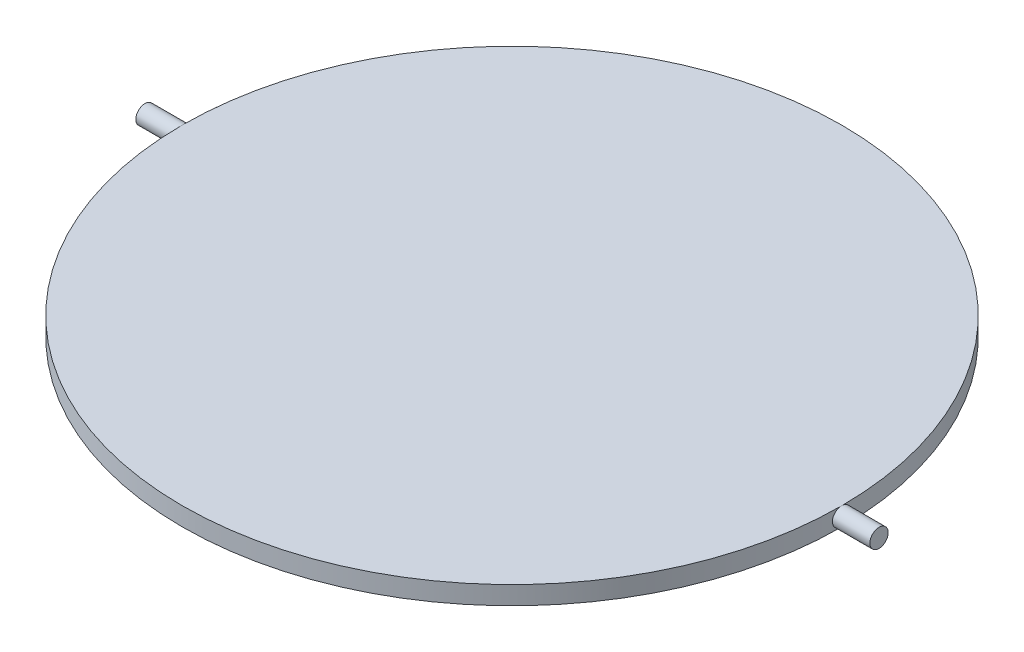
from build123d import *

# Parameters (mm, degrees)
BOSS_EXTRUDE3_DEPTH = 0.75
SKETCH6_R           = 0.75
BOSS_EXTRUDE4_DEPTH = 30


with BuildPart() as part:
    # Sketch2 → Boss-Extrude3 (new, symmetric)
    with BuildSketch(Plane(origin=(0, 0, 0), x_dir=(1, 0, 0), z_dir=(0, 1, 0))):
        with BuildLine():
            ThreePointArc((26.95, 0), (19.056527753, 19.056527753), (0, 26.95))
            Line((0, 26.95), (0, -26.95))
            ThreePointArc((0, -26.95), (19.056527753, -19.056527753), (26.95, 0))
        make_face()
        with BuildLine():
            Line((0, -26.95), (0, 26.95))
            ThreePointArc((0, 26.95), (-26.95, 0), (0, -26.95))
        make_face()
    extrude(amount=BOSS_EXTRUDE3_DEPTH, both=True)

    # Sketch6 → Boss-Extrude4 (add, symmetric)
    with BuildSketch(Plane(origin=(0, 0, 0), x_dir=(0, 0, -1), z_dir=(1, 0, 0))):
        with Locations(Location((0, 0, 0), (0, 0, 90))):
            Circle(SKETCH6_R)
    extrude(amount=BOSS_EXTRUDE4_DEPTH, both=True)


solid = part.part
